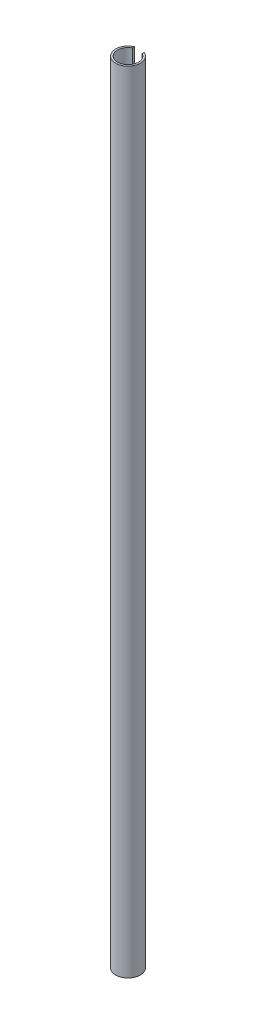
from build123d import *

# Parameters (mm, degrees)
SKETCH1_R     = 4.7625
SKETCH1_R_2   = 4.0513
SHAFT_DEPTH   = 304.8
CUTAWAY_DEPTH = 305.874404981


with BuildPart() as part:
    # Sketch1 → Shaft (new body)
    with BuildSketch(Plane(origin=(0, 0, 0), x_dir=(1, 0, 0), z_dir=(0, 1, 0))):
        with Locations(Location((0, 0, 0), (0, 0, 270))):
            Circle(SKETCH1_R)
        with Locations(Location((0, 0, 0), (0, 0, 270))):
            Circle(SKETCH1_R_2, mode=Mode.SUBTRACT)
    extrude(amount=-SHAFT_DEPTH)

    # Sketch2 → Cutaway (cut, through all)
    with BuildSketch(Plane.XY):
        with BuildLine():
            Line((-1.27, -6.35), (1.27, -6.35))
            ThreePointArc((1.27, -6.35), (1.719012806, -6.164012806), (1.905, -5.715))
            Line((1.905, -5.715), (1.905, 0))
            Line((1.905, 0), (-1.905, 0))
            Line((-1.905, 0), (-1.905, -5.715))
            ThreePointArc((-1.905, -5.715), (-1.719012806, -6.164012806), (-1.27, -6.35))
        make_face()
    extrude(amount=-CUTAWAY_DEPTH, mode=Mode.SUBTRACT)


solid = part.part
